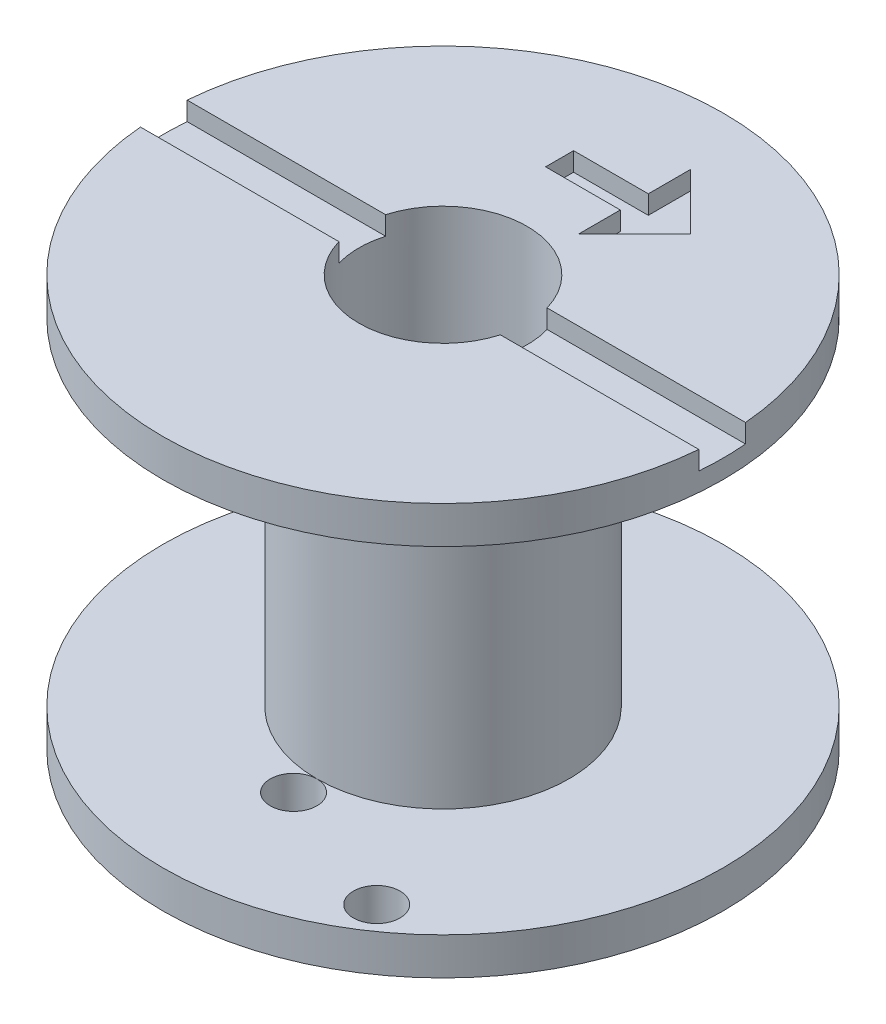
from build123d import *

# Parameters (mm, degrees)
CUT_EXTRUDE2_DEPTH      = 1
CUT_EXTRUDE3_DEPTH      = 17
CUT_EXTRUDE3_DEPTH_BACK = 1
CUT_EXTRUDE3_START      = -40
SKETCH5_W               = 42.611665196
SKETCH5_H               = 2.5
SKETCH3_R               = 1.25
CUT_EXTRUDE1_DEPTH      = 9.5


with BuildPart() as part:
    # Sketch2 → Revolve1 (revolve)
    with BuildSketch(Plane(origin=(0, 0, 0), x_dir=(0, 0, -1), z_dir=(1, 0, 0))):
        Polygon((-15, 11), (-15, 9), (-6.75, 9), (-6.75, -9), (-15, -9), (-15, -11), (-8.5, -11), (-8.5, -13), (-4.5, -13), (-4.5, -12), (-4.5, 11), align=None)
    revolve(axis=Axis((0, 15.5, 0), (0, -1, 0)))

    # Sketch4 → Cut-Extrude2 (cut)
    with BuildSketch(Plane(origin=(0, 11, 0), x_dir=(1, 0, 0), z_dir=(0, 1, 0))):
        Polygon((-2.25827734, 9.25), (1.74172266, 9.25), (1.74172266, 11.500000233), (4.74172266, 8.5), (1.74172266, 5.500000233), (1.74172266, 7.75), (-2.25827734, 7.75), align=None)
    extrude(amount=-CUT_EXTRUDE2_DEPTH, mode=Mode.SUBTRACT)

    # Sketch5 → Cut-Extrude3 (cut, two sides: drawn at the far end of the back side and taken through both)
    with BuildSketch(Plane.XZ.offset(13).offset(CUT_EXTRUDE3_START - CUT_EXTRUDE3_DEPTH_BACK)):
        Rectangle(SKETCH5_W, SKETCH5_H)
    extrude(amount=CUT_EXTRUDE3_DEPTH + CUT_EXTRUDE3_DEPTH_BACK, mode=Mode.SUBTRACT)

    # Sketch3 → Cut-Extrude1 (cut, symmetric)
    with BuildSketch(Plane.XZ.offset(11)):
        with Locations(Location((0, 8, 0), (0, 0, 270))):
            Circle(SKETCH3_R)
        with Locations(Location((7.425425002, 10.973858189, 0), (0, 0, 270))):
            Circle(SKETCH3_R)
    extrude(amount=CUT_EXTRUDE1_DEPTH, both=True, mode=Mode.SUBTRACT)


solid = part.part
